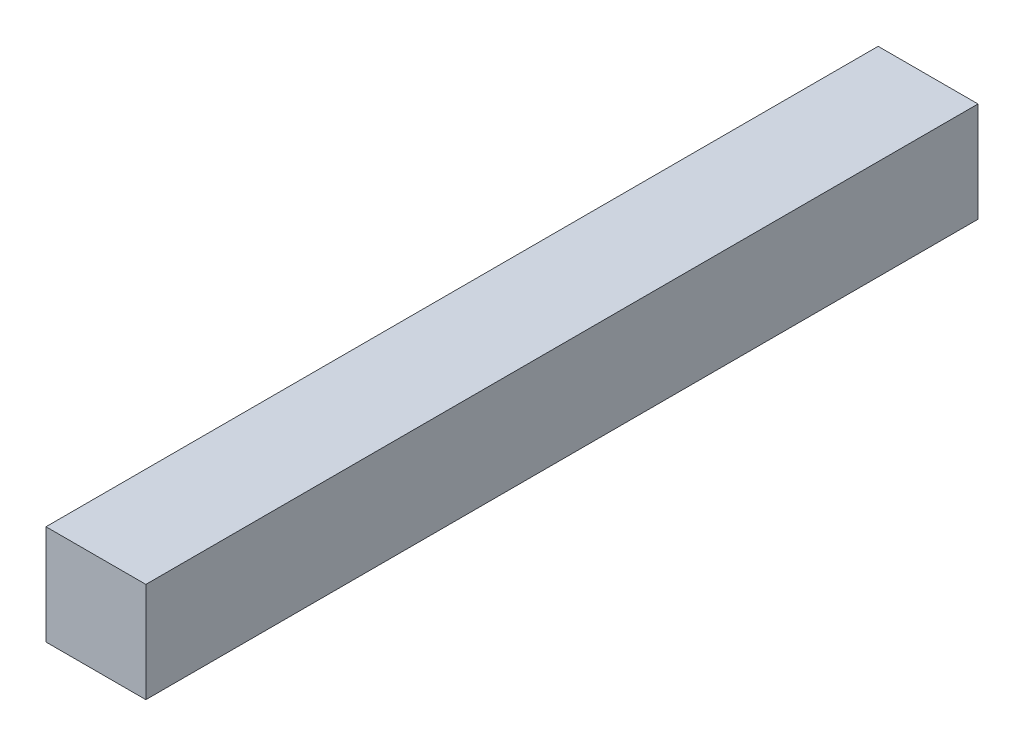
from build123d import *

# Parameters (mm, degrees)
BOSS_EXTRUDE1_DEPTH = 250
SKETCH3_W           = 20
SKETCH3_H           = 20
CUT_EXTRUDE1_DEPTH  = 20


with BuildPart() as part:
    # Sketch1 → Boss-Extrude1 (new body)
    with BuildSketch(Plane.XY):
        Polygon((0, 15), (-15, 15), (-15, -15), (15, -15), (15, 15), align=None)
    extrude(amount=BOSS_EXTRUDE1_DEPTH)

    # Sketch3 → Cut-Extrude1 (cut)
    with BuildSketch(Plane(origin=(0, -15, 0), x_dir=(-1, 0, 0), z_dir=(0, -1, 0))):
        with Locations((0, -235)):
            Rectangle(SKETCH3_W, SKETCH3_H)
        with Locations((0, -15)):
            Rectangle(SKETCH3_W, SKETCH3_H)
    extrude(amount=-CUT_EXTRUDE1_DEPTH, mode=Mode.SUBTRACT)


solid = part.part
